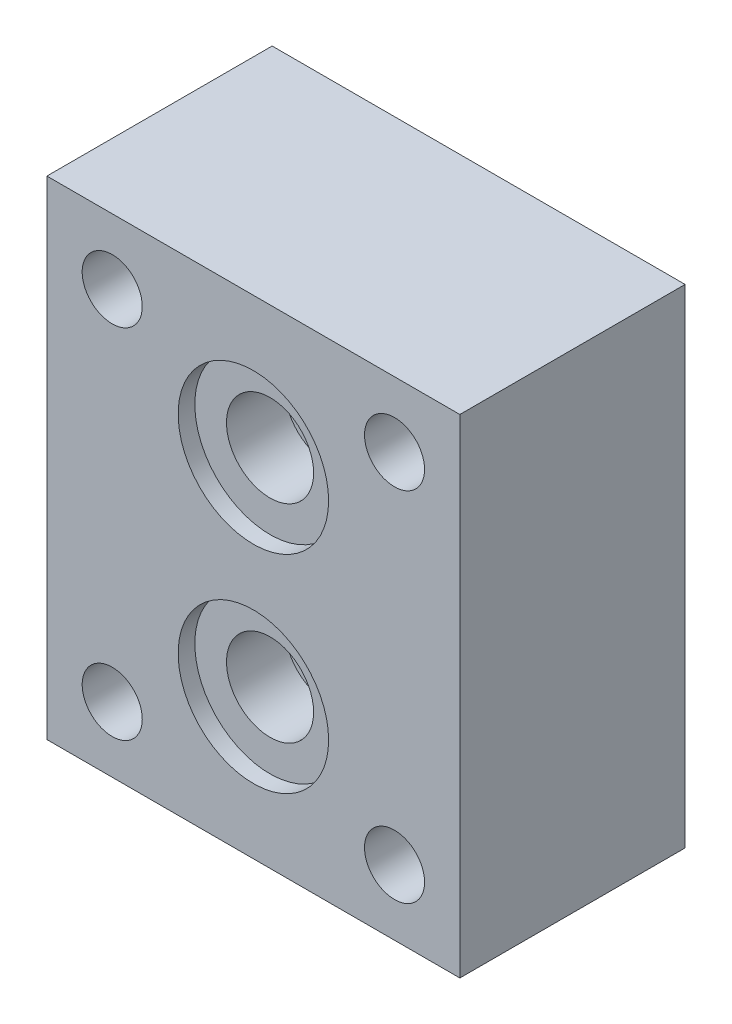
from build123d import *

# Parameters (mm, degrees)
SKETCH1_W           = 82.55
SKETCH1_H           = 69.85
BOSS_EXTRUDE1_DEPTH = 19.05
CUT_EXTRUDE2_START  = -19.05
SKETCH2_R           = 5.08
CUT_EXTRUDE2_DEPTH  = 38.1
CUT_EXTRUDE4_START  = -19.05
SKETCH3_R           = 5.08
CUT_EXTRUDE4_DEPTH  = 38.1
CUT_EXTRUDE6_START  = 19.05
SKETCH4_R           = 7.366
CUT_EXTRUDE6_DEPTH  = 12.7
CUT_EXTRUDE8_START  = 19.05
SKETCH5_R           = 12.7254
CUT_EXTRUDE8_DEPTH  = 2.8194
CUT_EXTRUDE10_START = 19.05
SKETCH6_R           = 7.366
CUT_EXTRUDE10_DEPTH = 12.7
CUT_EXTRUDE12_START = 19.05
SKETCH7_R           = 12.7254
CUT_EXTRUDE12_DEPTH = 2.8194


with BuildPart() as part:
    # Sketch1 → Boss-Extrude1 (new, symmetric)
    with BuildSketch(Plane(origin=(0, 0, 0), x_dir=(0, 1, 0), z_dir=(0, 0, 1))):
        Rectangle(SKETCH1_W, SKETCH1_H)
    extrude(amount=BOSS_EXTRUDE1_DEPTH, both=True)

    # Sketch2 → Cut-Extrude2 (cut)
    with BuildSketch(Plane(origin=(0, 0, 0), x_dir=(0, 1, 0), z_dir=(0, 0, 1)).offset(CUT_EXTRUDE2_START)):
        with Locations(Location((-30.226, -23.876, 0), (0, 0, 270))):
            Circle(SKETCH2_R)
    extrude(amount=CUT_EXTRUDE2_DEPTH, mode=Mode.SUBTRACT)

    # Sketch3 → Cut-Extrude4 (cut)
    with BuildSketch(Plane(origin=(0, 0, 0), x_dir=(0, 1, 0), z_dir=(0, 0, 1)).offset(CUT_EXTRUDE4_START)):
        with Locations(Location((30.226, -23.876, 0), (0, 0, 270))):
            Circle(SKETCH3_R)
        with Locations(Location((-30.226, 23.876, 0), (0, 0, 270))):
            Circle(SKETCH3_R)
        with Locations(Location((30.226, 23.876, 0), (0, 0, 270))):
            Circle(SKETCH3_R)
    extrude(amount=CUT_EXTRUDE4_DEPTH, mode=Mode.SUBTRACT)

    # Sketch4 → Cut-Extrude6 (cut)
    with BuildSketch(Plane(origin=(0, 0, 0), x_dir=(0, 1, 0), z_dir=(0, 0, 1)).offset(CUT_EXTRUDE6_START)):
        with Locations(Location((-17.526, 0, 0), (0, 0, 270))):
            Circle(SKETCH4_R)
    extrude(amount=-CUT_EXTRUDE6_DEPTH, mode=Mode.SUBTRACT)

    # Sketch5 → Cut-Extrude8 (cut)
    with BuildSketch(Plane(origin=(0, 0, 0), x_dir=(0, 1, 0), z_dir=(0, 0, 1)).offset(CUT_EXTRUDE8_START)):
        with Locations(Location((-17.526, 0, 0), (0, 0, 270))):
            Circle(SKETCH5_R)
    extrude(amount=-CUT_EXTRUDE8_DEPTH, mode=Mode.SUBTRACT)

    # Sketch6 → Cut-Extrude10 (cut)
    with BuildSketch(Plane(origin=(0, 0, 0), x_dir=(0, 1, 0), z_dir=(0, 0, 1)).offset(CUT_EXTRUDE10_START)):
        with Locations(Location((17.526, 0, 0), (0, 0, 270))):
            Circle(SKETCH6_R)
    extrude(amount=-CUT_EXTRUDE10_DEPTH, mode=Mode.SUBTRACT)

    # Sketch7 → Cut-Extrude12 (cut)
    with BuildSketch(Plane(origin=(0, 0, 0), x_dir=(0, 1, 0), z_dir=(0, 0, 1)).offset(CUT_EXTRUDE12_START)):
        with Locations(Location((17.526, 0, 0), (0, 0, 270))):
            Circle(SKETCH7_R)
    extrude(amount=-CUT_EXTRUDE12_DEPTH, mode=Mode.SUBTRACT)


solid = part.part
